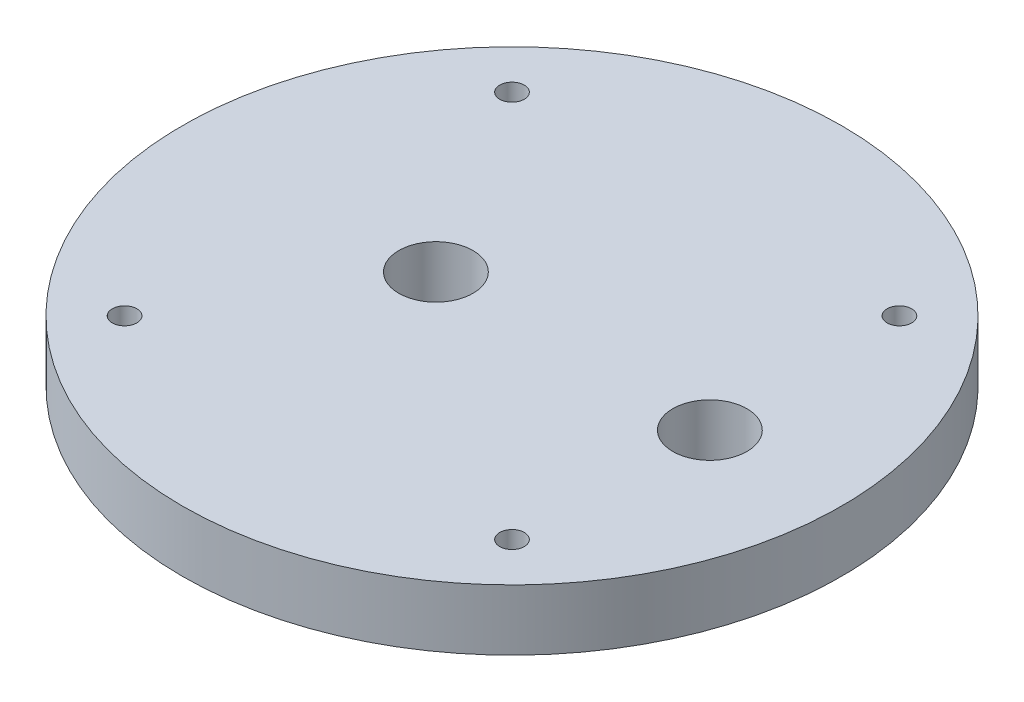
from build123d import *

# Parameters (mm, degrees)
SKETCH1_R           = 27.5
BOSS_EXTRUDE1_DEPTH = 5.08
SKETCH2_R           = 1.025
CUT_EXTRUDE1_DEPTH  = 3.175
SKETCH3_R           = 3.095
CUT_EXTRUDE2_DEPTH  = 40.221249343


with BuildPart() as part:
    # Sketch1 → Boss-Extrude1 (new body)
    with BuildSketch(Plane(origin=(0, 0, 0), x_dir=(1, 0, 0), z_dir=(0, 1, 0))):
        with Locations(Location((0, 0, 0), (0, 0, 270))):
            Circle(SKETCH1_R)
    extrude(amount=BOSS_EXTRUDE1_DEPTH)

    # Sketch2 → Cut-Extrude1 (cut)
    with BuildSketch(Plane(origin=(0, 5.08, 0), x_dir=(1, 0, 0), z_dir=(0, 1, 0))):
        with Locations(Location((16.164461018, 16.164461018, 0), (0, 0, 270))):
            Circle(SKETCH2_R)
        with Locations(Location((16.164461018, -16.164461018, 0), (0, 0, 270))):
            Circle(SKETCH2_R)
        with Locations(Location((-16.164461018, -16.164461018, 0), (0, 0, 270))):
            Circle(SKETCH2_R)
        with Locations(Location((-16.164461018, 16.164461018, 0), (0, 0, 270))):
            Circle(SKETCH2_R)
    extrude(amount=-CUT_EXTRUDE1_DEPTH, mode=Mode.SUBTRACT)

    # Sketch3 → Cut-Extrude2 (cut, through all)
    with BuildSketch(Plane(origin=(0, 5.08, 0), x_dir=(1, 0, 0), z_dir=(0, 1, 0))):
        with Locations(Location((-6.35, 0, 0), (0, 0, 270))):
            Circle(SKETCH3_R)
        with Locations(Location((16.51, 0, 0), (0, 0, 270))):
            Circle(SKETCH3_R)
    extrude(amount=-CUT_EXTRUDE2_DEPTH, mode=Mode.SUBTRACT)


solid = part.part
